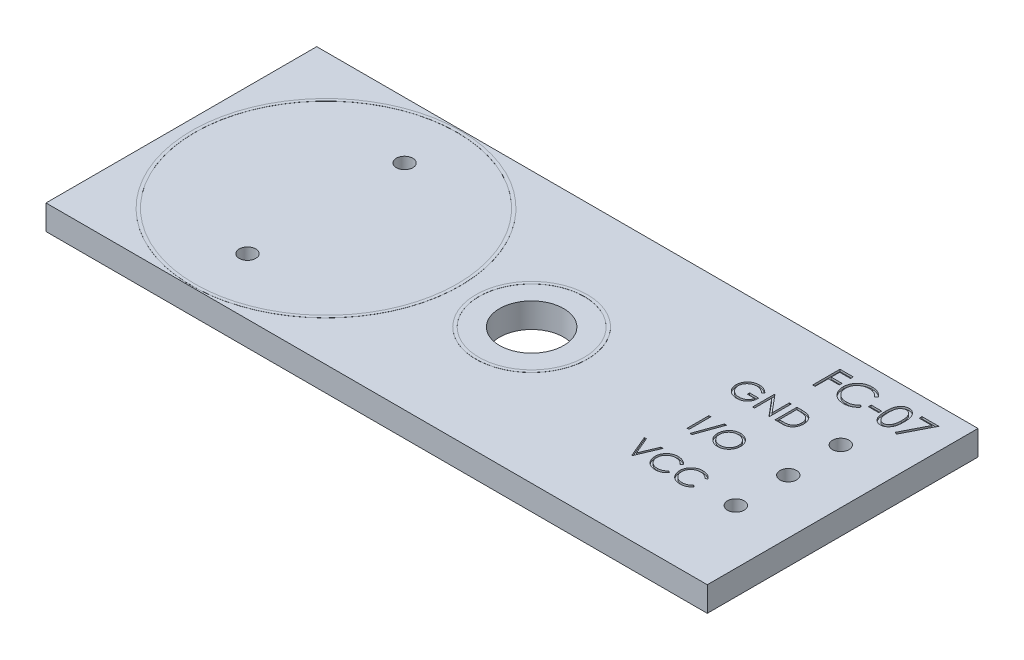
from build123d import *

# Parameters (mm, degrees)
SKETCH1_W           = 32
SKETCH1_H           = 13.1
BOSS_EXTRUDE1_DEPTH = 1.2
CUT_EXTRUDE1_REACH  = 19.33
SKETCH2_R           = 1.55
CUT_EXTRUDE2_REACH  = 19.33
SKETCH4_R           = 0.4
CUT_EXTRUDE3_REACH  = 19.33
SKETCH5_R           = 0.4
SKETCH6_W           = 0.094978632
SKETCH6_H           = 1.058333333
CUT_EXTRUDE4_DEPTH  = 0.1
SKETCH7_W           = 0.508814102
SKETCH7_H           = 0.13568376
CUT_EXTRUDE5_DEPTH  = 0.1
SKETCH8_R           = 6.5
SKETCH8_R_2         = 6.35
SKETCH8_R_3         = 2.7
SKETCH8_R_4         = 2.55
BOSS_EXTRUDE2_DEPTH = 0.005


with BuildPart() as part:
    # Sketch1 → Boss-Extrude1 (new body)
    with BuildSketch(Plane(origin=(0, 0, 0), x_dir=(1, 0, 0), z_dir=(0, 1, 0))):
        Rectangle(SKETCH1_W, SKETCH1_H)
    extrude(amount=BOSS_EXTRUDE1_DEPTH)

    # Sketch2 → Cut-Extrude1 (cut, up to next)
    with BuildSketch(Plane(origin=(0, 1.2, 0), x_dir=(1, 0, 0), z_dir=(0, 1, 0)), mode=Mode.PRIVATE) as cut_extrude1_sk1:
        with Locations(Location((0.95, 0, 0), (0, 0, 270))):
            Circle(SKETCH2_R)
    cut_extrude1_tool1 = extrude(cut_extrude1_sk1.sketch, amount=-CUT_EXTRUDE1_REACH, mode=Mode.PRIVATE) & part.part
    add(cut_extrude1_tool1.solids().sort_by_distance((0.95, 1.2, 0))[0], mode=Mode.SUBTRACT)

    # Sketch4 → Cut-Extrude2 (cut, up to next)
    with BuildSketch(Plane(origin=(0, 1.2, 0), x_dir=(1, 0, 0), z_dir=(0, 1, 0)), mode=Mode.PRIVATE) as cut_extrude2_sk1:
        with Locations(Location((13.37, 0, 0), (0, 0, 270))):
            Circle(SKETCH4_R)
    cut_extrude2_tool1 = extrude(cut_extrude2_sk1.sketch, amount=-CUT_EXTRUDE2_REACH, mode=Mode.PRIVATE) & part.part
    # Sketch4 → Cut-Extrude2 (cut, up to next)
    with BuildSketch(Plane(origin=(0, 1.2, 0), x_dir=(1, 0, 0), z_dir=(0, 1, 0)), mode=Mode.PRIVATE) as cut_extrude2_sk2:
        with Locations(Location((13.37, 2.54, 0), (0, 0, 270))):
            Circle(SKETCH4_R)
    cut_extrude2_tool2 = extrude(cut_extrude2_sk2.sketch, amount=-CUT_EXTRUDE2_REACH, mode=Mode.PRIVATE) & part.part
    # Sketch4 → Cut-Extrude2 (cut, up to next)
    with BuildSketch(Plane(origin=(0, 1.2, 0), x_dir=(1, 0, 0), z_dir=(0, 1, 0)), mode=Mode.PRIVATE) as cut_extrude2_sk3:
        with Locations(Location((13.37, -2.54, 0), (0, 0, 270))):
            Circle(SKETCH4_R)
    cut_extrude2_tool3 = extrude(cut_extrude2_sk3.sketch, amount=-CUT_EXTRUDE2_REACH, mode=Mode.PRIVATE) & part.part
    add(cut_extrude2_tool1.solids().sort_by_distance((13.37, 1.2, 0))[0], mode=Mode.SUBTRACT)
    add(cut_extrude2_tool2.solids().sort_by_distance((13.37, 1.2, -2.54))[0], mode=Mode.SUBTRACT)
    add(cut_extrude2_tool3.solids().sort_by_distance((13.37, 1.2, 2.54))[0], mode=Mode.SUBTRACT)

    # Sketch5 → Cut-Extrude3 (cut, up to next)
    with BuildSketch(Plane(origin=(0, 1.2, 0), x_dir=(1, 0, 0), z_dir=(0, 1, 0)), mode=Mode.PRIVATE) as cut_extrude3_sk1:
        with Locations(Location((-9, -3.8, 0), (0, 0, 270))):
            Circle(SKETCH5_R)
    cut_extrude3_tool1 = extrude(cut_extrude3_sk1.sketch, amount=-CUT_EXTRUDE3_REACH, mode=Mode.PRIVATE) & part.part
    # Sketch5 → Cut-Extrude3 (cut, up to next)
    with BuildSketch(Plane(origin=(0, 1.2, 0), x_dir=(1, 0, 0), z_dir=(0, 1, 0)), mode=Mode.PRIVATE) as cut_extrude3_sk2:
        with Locations(Location((-9, 3.8, 0), (0, 0, 270))):
            Circle(SKETCH5_R)
    cut_extrude3_tool2 = extrude(cut_extrude3_sk2.sketch, amount=-CUT_EXTRUDE3_REACH, mode=Mode.PRIVATE) & part.part
    add(cut_extrude3_tool1.solids().sort_by_distance((-9, 1.2, 3.8))[0], mode=Mode.SUBTRACT)
    add(cut_extrude3_tool2.solids().sort_by_distance((-9, 1.2, -3.8))[0], mode=Mode.SUBTRACT)

    # Sketch6 → Cut-Extrude4 (cut)
    # profile 1 of 9: a face of its own
    with BuildSketch(Plane(origin=(0, 1.2, 0), x_dir=(1, 0, 0), z_dir=(0, 1, 0))):
        with BuildLine():
            Line((9.359822658, 2.876299306), (9.278412401, 2.799129167))
            add(Edge.make_bspline(
                [(9.278412401, 2.799129167), (9.263680738, 2.812987547), (9.234568695, 2.840373846), (9.187106907, 2.875906933), (9.137587904, 2.906346444), (9.086270077, 2.93111333), (9.034424276, 2.95087476), (8.98273867, 2.964943983), (8.931743422, 2.973916393), (8.897826192, 2.974989353), (8.88111339, 2.975518056)],
                knots=[0, 0, 0, 0, 1.08915593, 2.152340314, 3.188132944, 4.216796309, 5.218260357, 6.173443236, 7.099959455, 8, 8, 8, 8], degree=3))
            add(Edge.make_bspline(
                [(8.88111339, 2.975518056), (8.87085823, 2.97539299), (8.850374509, 2.975143181), (8.81994835, 2.971954811), (8.789841295, 2.967369245), (8.760110179, 2.960734439), (8.730697195, 2.952325509), (8.70170464, 2.941807048), (8.67307843, 2.929543914), (8.64508821, 2.915373595), (8.617952391, 2.89980707), (8.592323539, 2.882556678), (8.568038297, 2.864175306), (8.54555312, 2.844202748), (8.524738671, 2.822819919), (8.505099521, 2.800424586), (8.487326386, 2.776404889), (8.471272629, 2.751202759), (8.456951378, 2.725260835), (8.444309237, 2.698828812), (8.433696546, 2.671994361), (8.425299592, 2.644723809), (8.418371847, 2.617228131), (8.413498189, 2.589316941), (8.410750537, 2.560960356), (8.410275261, 2.541971661), (8.410036333, 2.532425775)],
                knots=[0, 0, 0, 0, 1.02818874, 2.053710826, 3.065248034, 4.081641283, 5.106893873, 6.131558223, 7.173050175, 8.228653731, 9.27666206, 10.308777013, 11.325269123, 12.329503258, 13.32196095, 14.316845687, 15.314881793, 16.315733098, 17.311955233, 18.285320748, 19.252783886, 20.203351036, 21.145449891, 22.095197417, 23.042428769, 24, 24, 24, 24], degree=3))
            add(Edge.make_bspline(
                [(8.410036333, 2.532425775), (8.410264848, 2.522667695), (8.410721253, 2.50317818), (8.41364235, 2.474090925), (8.419063508, 2.445435672), (8.426310887, 2.41711826), (8.435376515, 2.389090192), (8.446677297, 2.361472981), (8.460062371, 2.334267649), (8.475555329, 2.307719321), (8.492544967, 2.281858788), (8.511577755, 2.257499123), (8.531795122, 2.234315945), (8.553933611, 2.212823988), (8.57728333, 2.192448382), (8.602541899, 2.173750498), (8.629212643, 2.156370178), (8.657336252, 2.140526468), (8.68660757, 2.126372459), (8.716620921, 2.113786185), (8.747472189, 2.103420767), (8.778999241, 2.094972816), (8.811164492, 2.088048202), (8.844131213, 2.083593381), (8.877657008, 2.080360677), (8.900256547, 2.080124315), (8.911642236, 2.080005236)],
                knots=[0, 0, 0, 0, 0.93586088, 1.869166235, 2.799637598, 3.729985548, 4.670839027, 5.622275134, 6.589130586, 7.576015415, 8.568469353, 9.55398029, 10.53834874, 11.515998671, 12.510579167, 13.508179873, 14.527009472, 15.561807829, 16.601455013, 17.643573243, 18.680854198, 19.719860599, 20.772568776, 21.833555941, 22.908541556, 24, 24, 24, 24], degree=3))
            add(Edge.make_bspline(
                [(8.911642236, 2.080005236), (8.925363784, 2.080292067), (8.952308272, 2.080855307), (8.991916077, 2.085239918), (9.02995653, 2.092087877), (9.066322739, 2.102116613), (9.101056943, 2.114908438), (9.134286475, 2.130328472), (9.165749715, 2.148968159), (9.195541246, 2.170005971), (9.22298449, 2.19344498), (9.247735618, 2.21873747), (9.269399849, 2.245760671), (9.28830008, 2.274355421), (9.303935792, 2.304758406), (9.316769685, 2.336820633), (9.326607132, 2.370556524), (9.330645422, 2.393867565), (9.332685906, 2.405646261)],
                knots=[0, 0, 0, 0, 1.13008108, 2.219097802, 3.278683437, 4.311054135, 5.322181354, 6.324827112, 7.324222904, 8.330512327, 9.32562643, 10.293043162, 11.24128371, 12.174520618, 13.111833804, 14.052305215, 15.015860969, 16, 16, 16, 16], degree=3))
            Line((9.332685906, 2.405646261), (8.979908128, 2.405646261))
            Line((8.979908128, 2.405646261), (8.979908128, 2.51419327))
            Line((8.979908128, 2.51419327), (9.427664538, 2.51419327))
            add(Edge.make_bspline(
                [(9.427664538, 2.51419327), (9.427148722, 2.49396172), (9.426139177, 2.454364921), (9.419057743, 2.396619149), (9.40762275, 2.342078184), (9.392001655, 2.290684589), (9.371779845, 2.242511193), (9.347174342, 2.197509086), (9.317791343, 2.155968994), (9.284677472, 2.117551796), (9.247514866, 2.0832832), (9.207307688, 2.053164262), (9.163989509, 2.027793709), (9.117601305, 2.007152985), (9.068294936, 1.991043944), (9.015956307, 1.979622539), (8.960656394, 1.972779669), (8.922756971, 1.971905371), (8.903374007, 1.971458227)],
                knots=[0, 0, 0, 0, 1.140356446, 2.231883559, 3.274166699, 4.278491846, 5.25512956, 6.21435461, 7.1637429, 8.11826594, 9.068280886, 10.0076534, 10.945064095, 11.891975133, 12.864533718, 13.863980011, 14.907571808, 16, 16, 16, 16], degree=3))
            add(Edge.make_bspline(
                [(8.903374007, 1.971458227), (8.891426894, 1.971630318), (8.867863338, 1.971969738), (8.833062034, 1.974381936), (8.799220277, 1.978095348), (8.766342998, 1.983703041), (8.734309261, 1.990571519), (8.703279053, 1.999366789), (8.67313417, 2.009547562), (8.643828017, 2.021127445), (8.615626594, 2.034544588), (8.58840429, 2.049454884), (8.562010629, 2.065781448), (8.536625395, 2.083806632), (8.512116324, 2.103395614), (8.488641449, 2.124587656), (8.466069353, 2.147317971), (8.451929879, 2.163458767), (8.444805297, 2.171591774)],
                knots=[0, 0, 0, 0, 1.107784379, 2.184907829, 3.233506516, 4.263428166, 5.276301166, 6.270063455, 7.25232949, 8.225834625, 9.190232166, 10.146266622, 11.1027726, 12.066435141, 13.031522626, 14.010570082, 14.99756817, 16, 16, 16, 16], degree=3))
            add(Edge.make_bspline(
                [(8.444805297, 2.171591774), (8.434468122, 2.184494567), (8.413965359, 2.210085979), (8.387574107, 2.251088819), (8.36507654, 2.293543668), (8.34682246, 2.33756871), (8.332568801, 2.383122767), (8.322346434, 2.430147629), (8.316357087, 2.478703851), (8.315494232, 2.511562157), (8.3150577, 2.528185658)],
                knots=[0, 0, 0, 0, 1.023165419, 2.029347347, 3.013907458, 3.994755782, 4.975994455, 5.96558838, 6.970761222, 8, 8, 8, 8], degree=3))
            add(Edge.make_bspline(
                [(8.3150577, 2.528185658), (8.315218639, 2.540633548), (8.315538471, 2.565371125), (8.319416663, 2.602097501), (8.324980901, 2.638171758), (8.333159415, 2.673564407), (8.343469476, 2.708299086), (8.35633684, 2.742391923), (8.371318273, 2.775863036), (8.38873103, 2.808482039), (8.40810895, 2.839816088), (8.429139612, 2.869739043), (8.452121653, 2.897705974), (8.476679763, 2.924071068), (8.503106949, 2.9485031), (8.531155631, 2.971228272), (8.560847428, 2.992277066), (8.592275749, 3.011317944), (8.624971501, 3.028421706), (8.658856311, 3.043416539), (8.693919835, 3.055809113), (8.729899382, 3.066324042), (8.767067293, 3.07409981), (8.805153848, 3.079738836), (8.844357573, 3.083597398), (8.870857039, 3.083907718), (8.884293478, 3.084065065)],
                knots=[0, 0, 0, 0, 1.008945113, 2.00506715, 2.99143336, 3.967273523, 4.948097931, 5.927297278, 6.919902385, 7.919676788, 8.923139349, 9.905703106, 10.883022732, 11.856032218, 12.825136022, 13.798837087, 14.781400844, 15.773989409, 16.776158564, 17.77167057, 18.775803737, 19.789618931, 20.80898985, 21.851988756, 22.910860228, 24, 24, 24, 24], degree=3))
            add(Edge.make_bspline(
                [(8.884293478, 3.084065065), (8.895251232, 3.083889837), (8.916979172, 3.083542382), (8.949311477, 3.081134024), (8.981144031, 3.077316803), (9.012524035, 3.072107751), (9.043344627, 3.065012778), (9.073693607, 3.05652244), (9.103614969, 3.046637055), (9.133014939, 3.034847571), (9.162091201, 3.021466117), (9.191005424, 3.006403487), (9.219658815, 2.989402117), (9.248101064, 2.970411524), (9.276511526, 2.949757871), (9.304440835, 2.926850451), (9.332563154, 2.902592618), (9.350646083, 2.885150624), (9.359822658, 2.876299306)],
                knots=[0, 0, 0, 0, 0.985871117, 1.954866573, 2.915460327, 3.869826059, 4.81536089, 5.759505086, 6.70452669, 7.649098992, 8.607881297, 9.583363685, 10.581137262, 11.603961102, 12.659522466, 13.73993555, 14.853081303, 16, 16, 16, 16], degree=3))
        make_face()
    # profile 2 of 9: a face of its own
    with BuildSketch(Plane(origin=(0, 1.2, 0), x_dir=(1, 0, 0), z_dir=(0, 1, 0))):
        Polygon((9.644758555, 1.998594979), (9.644758555, 3.056928312), (9.664687108, 3.056928312), (10.363882487, 2.223957225), (10.363882487, 3.056928312), (10.458861119, 3.056928312), (10.458861119, 1.998594979), (10.43723652, 1.998594979), (9.739737188, 2.829658013), (9.739737188, 1.998594979), align=None)
    # profile 3 of 9: a face of its own
    with BuildSketch(Plane(origin=(0, 1.2, 0), x_dir=(1, 0, 0), z_dir=(0, 1, 0))):
        with BuildLine():
            Line((10.730228641, 1.998594979), (10.730228641, 3.056928312))
            Line((10.730228641, 3.056928312), (10.943930564, 3.056928312))
            add(Edge.make_bspline(
                [(10.943930564, 3.056928312), (10.962517615, 3.056794488), (10.998427701, 3.056535939), (11.050320036, 3.054896614), (11.098333222, 3.051996639), (11.142309348, 3.047772521), (11.182369143, 3.04258577), (11.218400437, 3.036084457), (11.250589537, 3.028407558), (11.270386249, 3.021862386), (11.279747871, 3.018767255)],
                knots=[0, 0, 0, 0, 1.314313732, 2.53924729, 3.670748893, 4.714932338, 5.66265055, 6.526160246, 7.303039223, 8, 8, 8, 8], degree=3))
            add(Edge.make_bspline(
                [(11.279747871, 3.018767255), (11.291992709, 3.014101303), (11.316204713, 3.004875209), (11.350678295, 2.987471279), (11.38313144, 2.96775208), (11.413738182, 2.945691616), (11.441799384, 2.920665254), (11.468411296, 2.893736088), (11.492485272, 2.863924851), (11.514531352, 2.831849795), (11.534408563, 2.79788877), (11.551686356, 2.762106487), (11.56603554, 2.724684665), (11.577947301, 2.68572737), (11.587335158, 2.645148942), (11.593740171, 2.60290213), (11.597964732, 2.559153899), (11.598389291, 2.529467811), (11.598604709, 2.514405276)],
                knots=[0, 0, 0, 0, 0.984719456, 1.947108742, 2.898477687, 3.838006223, 4.779231079, 5.722358779, 6.681677486, 7.655904652, 8.64651281, 9.637519902, 10.640069247, 11.656948941, 12.698408672, 13.768548281, 14.867775369, 16, 16, 16, 16], degree=3))
            add(Edge.make_bspline(
                [(11.598604709, 2.514405276), (11.598414521, 2.501323901), (11.598039736, 2.475545686), (11.594674443, 2.437554273), (11.589783032, 2.400689931), (11.582210144, 2.365128207), (11.573017003, 2.330557532), (11.561234986, 2.297346353), (11.547738062, 2.265190011), (11.53199917, 2.234523298), (11.514720703, 2.205469516), (11.496178176, 2.178081202), (11.476391366, 2.15274917), (11.455171591, 2.129396709), (11.432793068, 2.108059022), (11.409109282, 2.088557865), (11.384059121, 2.071274812), (11.357754784, 2.05553071), (11.329428907, 2.04179646), (11.298544966, 2.030175957), (11.264971253, 2.020546147), (11.228790175, 2.012511614), (11.189939219, 2.006138239), (11.148380294, 2.001866687), (11.104177251, 1.998978062), (11.073824473, 1.998725153), (11.058201731, 1.998594979)],
                knots=[0, 0, 0, 0, 1.105936401, 2.179363191, 3.223086493, 4.248585256, 5.251745608, 6.245858792, 7.225916811, 8.198733463, 9.158002045, 10.082870192, 10.993790845, 11.873723703, 12.748670949, 13.606408763, 14.465103618, 15.319838547, 16.196477973, 17.123216899, 18.106603292, 19.147568657, 20.255746949, 21.433717677, 22.679120308, 24, 24, 24, 24], degree=3))
            Line((11.058201731, 1.998594979), (10.730228641, 1.998594979))
        make_face()
        with BuildLine():
            Line((10.825207273, 2.107141988), (10.94668664, 2.107141988))
            add(Edge.make_bspline(
                [(10.94668664, 2.107141988), (10.9641426, 2.107217007), (10.997716803, 2.107361297), (11.04599434, 2.108627428), (11.090105491, 2.1106963), (11.130056519, 2.113591621), (11.165824867, 2.117422369), (11.197485287, 2.12169347), (11.224933996, 2.127014604), (11.241543611, 2.13183787), (11.249219025, 2.134066734)],
                knots=[0, 0, 0, 0, 1.375205317, 2.645023457, 3.804390687, 4.853969522, 5.800190428, 6.637939096, 7.370582563, 8, 8, 8, 8], degree=3))
            add(Edge.make_bspline(
                [(11.249219025, 2.134066734), (11.258879601, 2.137468991), (11.277970011, 2.144192242), (11.30545072, 2.156456106), (11.331079624, 2.170983113), (11.35530337, 2.187130943), (11.377778335, 2.205469139), (11.398770865, 2.225598938), (11.418238695, 2.247622787), (11.435980688, 2.27151335), (11.451858199, 2.297121931), (11.465607833, 2.324196769), (11.477658177, 2.352441209), (11.487116228, 2.382288978), (11.494529274, 2.413473241), (11.499780024, 2.445996192), (11.503050191, 2.479851755), (11.503431629, 2.502878707), (11.503626077, 2.514617281)],
                knots=[0, 0, 0, 0, 0.998632004, 1.973411704, 2.929992603, 3.868527914, 4.809262121, 5.754881198, 6.702106254, 7.672490631, 8.653608572, 9.636854334, 10.631411391, 11.644891563, 12.686317036, 13.754757253, 14.855430412, 16, 16, 16, 16], degree=3))
            add(Edge.make_bspline(
                [(11.503626077, 2.514617281), (11.503470868, 2.526994786), (11.50316596, 2.551310504), (11.49933349, 2.586988643), (11.493732924, 2.62130303), (11.485634048, 2.65425596), (11.47531352, 2.685911724), (11.462433712, 2.716095243), (11.447717853, 2.745125286), (11.430208987, 2.772331821), (11.41103332, 2.798062356), (11.389752389, 2.821634438), (11.366704297, 2.843101762), (11.342140426, 2.862798649), (11.315368493, 2.879932665), (11.287019163, 2.895259352), (11.256676543, 2.908266539), (11.235566514, 2.915184671), (11.22483835, 2.918700481)],
                knots=[0, 0, 0, 0, 1.122418816, 2.205001699, 3.251619955, 4.274784885, 5.280384055, 6.268708349, 7.249350384, 8.229342522, 9.199999885, 10.157847722, 11.105861043, 12.055065948, 13.010012805, 13.98527497, 14.976112212, 16, 16, 16, 16], degree=3))
            add(Edge.make_bspline(
                [(11.22483835, 2.918700481), (11.215963122, 2.921154734), (11.197091953, 2.92637315), (11.166297639, 2.932065584), (11.131640201, 2.937086468), (11.092965767, 2.941337352), (11.050318424, 2.944387566), (11.00366537, 2.946676987), (10.952986442, 2.948221135), (10.917855057, 2.948326578), (10.899621336, 2.948381304)],
                knots=[0, 0, 0, 0, 0.674548936, 1.434276114, 2.292660221, 3.240891867, 4.284742987, 5.42552168, 6.663806718, 8, 8, 8, 8], degree=3))
            Line((10.899621336, 2.948381304), (10.825207273, 2.948381304))
            Line((10.825207273, 2.948381304), (10.825207273, 2.107141988))
        make_face(mode=Mode.SUBTRACT)
    # profile 4 of 9: a face of its own
    with BuildSketch(Plane(origin=(0, 1.2, 0), x_dir=(1, 0, 0), z_dir=(0, 1, 0))):
        with Locations((9.000260692, 0.046631621)):
            Rectangle(SKETCH6_W, SKETCH6_H)
    # profile 5 of 9: a face of its own
    with BuildSketch(Plane(origin=(0, 1.2, 0), x_dir=(1, 0, 0), z_dir=(0, 1, 0))):
        Polygon((9.780442316, 0.60293504), (9.337774047, -0.631787182), (9.237707273, -0.631787182), (9.680375542, 0.60293504), align=None)
    # profile 6 of 9: a face of its own
    with BuildSketch(Plane(origin=(0, 1.2, 0), x_dir=(1, 0, 0), z_dir=(0, 1, 0))):
        with BuildLine():
            add(Edge.make_bspline(
                [(10.452076931, 0.60293504), (10.471673668, 0.602438688), (10.510163276, 0.601463812), (10.566731162, 0.594001321), (10.620734917, 0.581091048), (10.672614459, 0.563896765), (10.72174924, 0.540959844), (10.768509095, 0.513236002), (10.812782769, 0.480434787), (10.85397352, 0.442809759), (10.891667407, 0.401872381), (10.924876663, 0.358185013), (10.9527085, 0.312011804), (10.975564202, 0.263491505), (10.993494972, 0.212733848), (11.005868112, 0.159468233), (11.01377179, 0.104039781), (11.014695799, 0.066234039), (11.015164538, 0.047055633)],
                knots=[0, 0, 0, 0, 1.065120563, 2.091984664, 3.0946048, 4.079830382, 5.057816894, 6.036188127, 7.030412546, 8.04752943, 9.064399622, 10.05169764, 11.02544977, 11.989514704, 12.962713494, 13.945757189, 14.957906945, 16, 16, 16, 16], degree=3))
            add(Edge.make_bspline(
                [(11.015164538, 0.047055633), (11.014695868, 0.028018501), (11.013772065, -0.009505893), (11.005859125, -0.064582601), (10.993449108, -0.117526693), (10.975730714, -0.168249783), (10.952983962, -0.21680538), (10.924966803, -0.263065721), (10.89196458, -0.307045971), (10.854406794, -0.348264325), (10.813464098, -0.386061179), (10.769549231, -0.418996172), (10.723649823, -0.447336562), (10.675175221, -0.469949721), (10.624768305, -0.488023611), (10.571977935, -0.50034643), (10.517051477, -0.508295131), (10.479595245, -0.509207873), (10.460557166, -0.509671797)],
                knots=[0, 0, 0, 0, 1.043624062, 2.057103931, 3.04512605, 4.022047818, 4.998200453, 5.980619268, 6.982898556, 8.009068085, 9.034988726, 10.034168286, 11.015286542, 11.987931943, 12.962482838, 13.94673481, 14.956375938, 16, 16, 16, 16], degree=3))
            add(Edge.make_bspline(
                [(10.460557166, -0.509671797), (10.44137886, -0.509203292), (10.403573314, -0.508279744), (10.34807521, -0.500362986), (10.294772178, -0.487983115), (10.243816648, -0.470290976), (10.195180205, -0.447425766), (10.148767728, -0.419544918), (10.10476551, -0.386462283), (10.063538363, -0.348916676), (10.025816581, -0.308043373), (9.992929818, -0.264248253), (9.9650427, -0.218390532), (9.942254264, -0.170342947), (9.924212868, -0.120337773), (9.911904506, -0.068041447), (9.903941016, -0.01375212), (9.903023336, 0.023211804), (9.9025577, 0.041967492)],
                knots=[0, 0, 0, 0, 1.053102029, 2.075944431, 3.073151272, 4.055350789, 5.033113405, 6.020478099, 7.024410459, 8.052272461, 9.079885166, 10.07527673, 11.055994387, 12.023226415, 12.992069828, 13.970394897, 14.97016774, 16, 16, 16, 16], degree=3))
            add(Edge.make_bspline(
                [(9.9025577, 0.041967492), (9.902719364, 0.054556418), (9.903040652, 0.079575456), (9.906908616, 0.116727975), (9.912521321, 0.153283008), (9.920565232, 0.189136604), (9.93108557, 0.224200997), (9.943498921, 0.258718013), (9.958660255, 0.292337853), (9.975799404, 0.325219784), (9.994928569, 0.356851222), (10.016057665, 0.386750524), (10.03844455, 0.415168588), (10.062986814, 0.441368991), (10.088875597, 0.46611393), (10.116530868, 0.489023133), (10.14578388, 0.510303177), (10.176760505, 0.529480281), (10.208697459, 0.54682459), (10.241619723, 0.561708341), (10.275080162, 0.574482745), (10.309235496, 0.584836518), (10.343995025, 0.593010491), (10.379434612, 0.598576524), (10.415526024, 0.602454354), (10.439840876, 0.602774122), (10.452076931, 0.60293504)],
                knots=[0, 0, 0, 0, 1.037015668, 2.060948919, 3.074880161, 4.083647147, 5.086022904, 6.090072063, 7.104153813, 8.122640571, 9.144368836, 10.147691507, 11.138137339, 12.123020368, 13.103399296, 14.087645067, 15.080126199, 16.082011238, 17.087798457, 18.072939717, 19.057185487, 20.037253025, 21.01195951, 21.997135196, 22.992090687, 24, 24, 24, 24], degree=3))
        make_face()
        with BuildLine():
            add(Edge.make_bspline(
                [(10.456741061, 0.494388032), (10.446697588, 0.494265601), (10.426706659, 0.494021909), (10.396987288, 0.490811919), (10.367658774, 0.486236928), (10.338715062, 0.479711088), (10.310277256, 0.470819862), (10.28208028, 0.460587016), (10.254381261, 0.448122544), (10.227271642, 0.434039845), (10.200990179, 0.418452433), (10.1761911, 0.401225256), (10.152810206, 0.382762312), (10.130904742, 0.363020514), (10.11053903, 0.341899325), (10.091312228, 0.319718945), (10.073994997, 0.295845397), (10.058124358, 0.27092606), (10.043922178, 0.244993391), (10.03129313, 0.218320409), (10.020962585, 0.190689537), (10.012537533, 0.162400542), (10.00555259, 0.133498227), (10.00112757, 0.103763339), (9.997882309, 0.073345293), (9.997652546, 0.052788875), (9.997536333, 0.042391504)],
                knots=[0, 0, 0, 0, 1.008559885, 2.007477868, 2.99961109, 3.989939068, 4.984837346, 5.991145699, 7.001802488, 8.033829008, 9.059044045, 10.069351652, 11.065060232, 12.050310815, 13.029377138, 14.011219647, 14.996725999, 15.989392538, 16.977580475, 17.965360261, 18.951710183, 19.937753436, 20.929683414, 21.935841486, 22.955955122, 24, 24, 24, 24], degree=3))
            add(Edge.make_bspline(
                [(9.997536333, 0.042391504), (9.997921827, 0.027102452), (9.998680213, -0.002975845), (10.005319764, -0.047053355), (10.015546885, -0.089413384), (10.030622803, -0.129824152), (10.049476441, -0.168633018), (10.072767905, -0.205495707), (10.100362914, -0.240422181), (10.13170879, -0.273168608), (10.165975418, -0.303057696), (10.202361744, -0.329293298), (10.240477954, -0.35149116), (10.280423446, -0.369575074), (10.321984964, -0.383904828), (10.365430318, -0.393725748), (10.4104701, -0.400189278), (10.441171036, -0.400809993), (10.456741061, -0.401124789)],
                knots=[0, 0, 0, 0, 1.032063989, 2.030389145, 3.003944642, 3.970395727, 4.937377036, 5.913328081, 6.909231446, 7.93887556, 8.970685674, 9.976071282, 10.964166581, 11.944589148, 12.933237628, 13.927779006, 14.949070134, 16, 16, 16, 16], degree=3))
            add(Edge.make_bspline(
                [(10.456741061, -0.401124789), (10.467206315, -0.400981005), (10.487962057, -0.400695839), (10.518833798, -0.397823621), (10.549149367, -0.393217793), (10.578866242, -0.386586381), (10.607950697, -0.378286868), (10.636524125, -0.368426913), (10.66428218, -0.356125691), (10.691575035, -0.342534287), (10.717699613, -0.327040239), (10.742638643, -0.310397751), (10.765763523, -0.291962002), (10.787652599, -0.27251352), (10.808101924, -0.251660166), (10.826973212, -0.229429052), (10.844202919, -0.205679853), (10.860067531, -0.180798314), (10.874219946, -0.154794685), (10.886550769, -0.128024996), (10.897011975, -0.100555166), (10.905457023, -0.072345571), (10.91207477, -0.043449791), (10.916634651, -0.013829134), (10.919824298, 0.016457143), (10.920064714, 0.036941595), (10.920185906, 0.047267639)],
                knots=[0, 0, 0, 0, 1.047197238, 2.076906641, 3.100256066, 4.114471768, 5.12198147, 6.126382909, 7.136867548, 8.15857795, 9.17633901, 10.174870724, 11.156907918, 12.133735059, 13.104061851, 14.077631395, 15.04955518, 16.038496417, 17.029181396, 18.010275684, 18.986308667, 19.968651475, 20.955262928, 21.950658345, 22.966943676, 24, 24, 24, 24], degree=3))
            add(Edge.make_bspline(
                [(10.920185906, 0.047267639), (10.920064617, 0.057523042), (10.919824018, 0.077866522), (10.916636174, 0.107941579), (10.912069953, 0.137349097), (10.905489324, 0.165973628), (10.897007492, 0.193822468), (10.886548942, 0.220869461), (10.874216244, 0.247215367), (10.860062329, 0.272795071), (10.844152306, 0.297340766), (10.826767142, 0.320806257), (10.807606668, 0.342750872), (10.787218322, 0.363716363), (10.76509284, 0.383255582), (10.741330446, 0.401375011), (10.71621962, 0.418511929), (10.689632099, 0.433971325), (10.662192856, 0.44824801), (10.634036968, 0.460479623), (10.605483407, 0.470873097), (10.576604783, 0.479737989), (10.547158025, 0.486211369), (10.517342106, 0.490816042), (10.487198275, 0.494020792), (10.466925682, 0.49426523), (10.456741061, 0.494388032)],
                knots=[0, 0, 0, 0, 1.02996197, 2.043119294, 3.035359645, 4.018872909, 4.991431989, 5.957985074, 6.929999688, 7.912076566, 8.892894881, 9.867085534, 10.843653904, 11.817741046, 12.803660682, 13.806313499, 14.818574707, 15.856120519, 16.894564902, 17.924820532, 18.937903209, 19.946497019, 20.957711757, 21.963978472, 22.977135795, 24, 24, 24, 24], degree=3))
        make_face(mode=Mode.SUBTRACT)
    # profile 7 of 9: a face of its own
    with BuildSketch(Plane(origin=(0, 1.2, 0), x_dir=(1, 0, 0), z_dir=(0, 1, 0))):
        Polygon((8.308273512, -1.905331736), (8.410036333, -1.905331736), (8.762814111, -2.739362853), (9.115591888, -1.905331736), (9.217354709, -1.905331736), (8.769598299, -2.963665069), (8.756029923, -2.963665069), align=None)
    # profile 8 of 9: a face of its own
    with BuildSketch(Plane(origin=(0, 1.2, 0), x_dir=(1, 0, 0), z_dir=(0, 1, 0))):
        with BuildLine():
            Line((10.384235051, -2.099529119), (10.301128747, -2.163130881))
            add(Edge.make_bspline(
                [(10.301128747, -2.163130881), (10.2952003, -2.156065457), (10.283423334, -2.142029866), (10.264476385, -2.122320813), (10.244730412, -2.103855841), (10.224192963, -2.086546987), (10.202494372, -2.070999537), (10.180160274, -2.056403275), (10.156817055, -2.043319935), (10.124537364, -2.027456127), (10.082310515, -2.010901933), (10.029153504, -1.99702167), (9.973663243, -1.988185743), (9.935805874, -1.987228755), (9.916550088, -1.986741993)],
                knots=[0, 0, 0, 0, 0.757959112, 1.505699292, 2.245454638, 2.979532153, 3.711538275, 4.438200793, 5.171680507, 5.909471876, 7.393775596, 8.890124382, 10.418191784, 12, 12, 12, 12], degree=3))
            add(Edge.make_bspline(
                [(9.916550088, -1.986741993), (9.905941567, -1.986864143), (9.884822981, -1.987107311), (9.853481657, -1.990315308), (9.822725568, -1.994824174), (9.792574719, -2.00151445), (9.763067492, -2.009972837), (9.734010979, -2.020080046), (9.70582587, -2.032584962), (9.678122259, -2.046406269), (9.651579498, -2.062017425), (9.626465234, -2.07904551), (9.602871062, -2.097299975), (9.58077832, -2.116849238), (9.560164421, -2.137605259), (9.541178735, -2.159789239), (9.523886956, -2.183330253), (9.507946331, -2.207917879), (9.4936701, -2.233480497), (9.481717018, -2.26011272), (9.471132135, -2.287358485), (9.462756412, -2.315525621), (9.456126856, -2.344415934), (9.451552539, -2.374106958), (9.448381025, -2.404536666), (9.448139066, -2.425161863), (9.448017102, -2.435558432)],
                knots=[0, 0, 0, 0, 1.054917814, 2.100044995, 3.131103042, 4.146048494, 5.169673617, 6.183595914, 7.203665975, 8.234915748, 9.262203917, 10.264457458, 11.251630812, 12.227803204, 13.197192746, 14.159520551, 15.12972552, 16.100847026, 17.073214652, 18.039054194, 19.002613845, 19.979014051, 20.95965708, 21.949030935, 22.966165397, 24, 24, 24, 24], degree=3))
            add(Edge.make_bspline(
                [(9.448017102, -2.435558432), (9.448398652, -2.451200998), (9.449147775, -2.481913101), (9.455814771, -2.5268985), (9.465946073, -2.569994037), (9.481130307, -2.610930323), (9.499853448, -2.650212136), (9.523511919, -2.687174837), (9.550912634, -2.722376988), (9.582443232, -2.754986641), (9.617037372, -2.784775316), (9.654154002, -2.811007039), (9.693700679, -2.832873682), (9.735240756, -2.851069742), (9.77909389, -2.865056895), (9.825181223, -2.874903666), (9.873402517, -2.881326897), (9.906352788, -2.881941845), (9.92312227, -2.882254813)],
                knots=[0, 0, 0, 0, 1.029171465, 2.020641659, 2.987623507, 3.938342917, 4.889210282, 5.84687017, 6.821220943, 7.821438502, 8.827599549, 9.822697543, 10.807740252, 11.797342354, 12.80366471, 13.83203677, 14.896651826, 16, 16, 16, 16], degree=3))
            add(Edge.make_bspline(
                [(9.92312227, -2.882254813), (9.94159856, -2.881744158), (9.977964317, -2.880739067), (10.031294649, -2.872224247), (10.082347368, -2.858418162), (10.131125222, -2.839096647), (10.177490698, -2.813979287), (10.221516355, -2.783530167), (10.263239354, -2.747459647), (10.288328289, -2.719917844), (10.301128747, -2.705865924)],
                knots=[0, 0, 0, 0, 1.028121516, 2.023589091, 2.998037872, 3.967518031, 4.937445131, 5.927275754, 6.942489185, 8, 8, 8, 8], degree=3))
            Line((10.301128747, -2.705865924), (10.384235051, -2.768831669))
            add(Edge.make_bspline(
                [(10.384235051, -2.768831669), (10.377546956, -2.777461154), (10.364202801, -2.794678787), (10.342595258, -2.818951423), (10.319832837, -2.841782406), (10.295746468, -2.862987663), (10.270613231, -2.882991513), (10.243981841, -2.901225638), (10.216202395, -2.917944548), (10.187369017, -2.933253166), (10.157512341, -2.946835286), (10.126668143, -2.958462973), (10.094969374, -2.968479308), (10.062414585, -2.976719775), (10.028936249, -2.983151746), (9.994655177, -2.987451504), (9.959497381, -2.990397274), (9.935778189, -2.990665763), (9.923758288, -2.990801822)],
                knots=[0, 0, 0, 0, 0.986787822, 1.968848986, 2.935600012, 3.899624008, 4.868462664, 5.837806735, 6.815139263, 7.798259679, 8.787526145, 9.778297419, 10.776456485, 11.791383307, 12.812564526, 13.85620153, 14.913611965, 16, 16, 16, 16], degree=3))
            add(Edge.make_bspline(
                [(9.923758288, -2.990801822), (9.91237556, -2.9907226), (9.889867625, -2.990565949), (9.856636336, -2.988028318), (9.824284725, -2.984566135), (9.792905255, -2.979353048), (9.762326686, -2.973201307), (9.732826223, -2.964954999), (9.704113577, -2.955717512), (9.676304102, -2.944860528), (9.649374145, -2.932609207), (9.623410564, -2.918762711), (9.5984253, -2.903437481), (9.574172709, -2.886971323), (9.551011058, -2.868835329), (9.528739635, -2.849281371), (9.507233553, -2.828375353), (9.493927979, -2.813300195), (9.487238189, -2.805720692)],
                knots=[0, 0, 0, 0, 1.114604814, 2.203992996, 3.262667896, 4.300477797, 5.318619304, 6.316056647, 7.298880507, 8.271930387, 9.238335007, 10.195173496, 11.151986948, 12.108099108, 13.064862484, 14.031167946, 15.010108607, 16, 16, 16, 16], degree=3))
            add(Edge.make_bspline(
                [(9.487238189, -2.805720692), (9.476523126, -2.792554666), (9.45522236, -2.766381565), (9.42797007, -2.723961756), (9.404642119, -2.67967256), (9.385780828, -2.633281296), (9.371035907, -2.584892062), (9.360821117, -2.534480466), (9.35418337, -2.482093588), (9.353424306, -2.446461988), (9.35303847, -2.428350232)],
                knots=[0, 0, 0, 0, 0.994628077, 1.977248131, 2.950237994, 3.925870899, 4.908910175, 5.911660606, 6.938484602, 8, 8, 8, 8], degree=3))
            add(Edge.make_bspline(
                [(9.35303847, -2.428350232), (9.353508731, -2.409313702), (9.35443394, -2.371860518), (9.362294573, -2.316895537), (9.37493978, -2.264235471), (9.392900268, -2.213978625), (9.415671172, -2.165860659), (9.443800648, -2.120249152), (9.476961903, -2.076852405), (9.514894858, -2.036328897), (9.5564926, -1.999275331), (9.601039003, -1.966676788), (9.648446878, -1.93954792), (9.698193942, -1.916870509), (9.750652708, -1.899439922), (9.80571125, -1.887237887), (9.863266113, -1.879642949), (9.902534037, -1.878682827), (9.922486253, -1.878194984)],
                knots=[0, 0, 0, 0, 1.032925535, 2.032216505, 3.007276963, 3.968222605, 4.92396291, 5.891752235, 6.871517503, 7.883894988, 8.900124299, 9.891468569, 10.874487609, 11.85992873, 12.854644235, 13.869047385, 14.917252991, 16, 16, 16, 16], degree=3))
            add(Edge.make_bspline(
                [(9.922486253, -1.878194984), (9.934646343, -1.878340773), (9.958716017, -1.878629349), (9.994322177, -1.881443349), (10.028987833, -1.886134368), (10.062736868, -1.892519465), (10.095733468, -1.90044406), (10.127725446, -1.910767436), (10.158900525, -1.92257134), (10.18906209, -1.936165923), (10.218065428, -1.951426105), (10.245901505, -1.968182734), (10.272349212, -1.986415037), (10.29759465, -2.005967949), (10.321215504, -2.027255133), (10.343882427, -2.049691072), (10.364825658, -2.073922015), (10.37775341, -2.090977792), (10.384235051, -2.099529119)],
                knots=[0, 0, 0, 0, 1.096760587, 2.17092713, 3.219439832, 4.250915756, 5.268269357, 6.278326846, 7.281116186, 8.274029601, 9.260640565, 10.235837813, 11.203064059, 12.156899882, 13.114053108, 14.069676657, 15.032185724, 16, 16, 16, 16], degree=3))
        make_face()
    # profile 9 of 9: a face of its own
    with BuildSketch(Plane(origin=(0, 1.2, 0), x_dir=(1, 0, 0), z_dir=(0, 1, 0))):
        with BuildLine():
            Line((11.578252145, -2.099529119), (11.495145841, -2.163130881))
            add(Edge.make_bspline(
                [(11.495145841, -2.163130881), (11.489217394, -2.156065457), (11.477440428, -2.142029866), (11.458493479, -2.122320813), (11.438747506, -2.103855841), (11.418210057, -2.086546987), (11.396511466, -2.070999537), (11.374177368, -2.056403275), (11.350834149, -2.043319935), (11.318554458, -2.027456127), (11.276327609, -2.010901933), (11.223170598, -1.99702167), (11.167680337, -1.988185743), (11.129822968, -1.987228755), (11.110567182, -1.986741993)],
                knots=[0, 0, 0, 0, 0.757959112, 1.505699292, 2.245454638, 2.979532153, 3.711538275, 4.438200793, 5.171680507, 5.909471876, 7.393775596, 8.890124382, 10.418191784, 12, 12, 12, 12], degree=3))
            add(Edge.make_bspline(
                [(11.110567182, -1.986741993), (11.099958661, -1.986864143), (11.078840075, -1.987107311), (11.047498751, -1.990315308), (11.016742662, -1.994824174), (10.986591813, -2.00151445), (10.957084586, -2.009972837), (10.928028073, -2.020080046), (10.899842964, -2.032584962), (10.872139353, -2.046406269), (10.845596592, -2.062017425), (10.820482328, -2.07904551), (10.796888156, -2.097299975), (10.774795414, -2.116849238), (10.754181515, -2.137605259), (10.735195829, -2.159789239), (10.71790405, -2.183330253), (10.701963425, -2.207917879), (10.687687194, -2.233480497), (10.675734112, -2.26011272), (10.665149229, -2.287358485), (10.656773506, -2.315525621), (10.65014395, -2.344415934), (10.645569633, -2.374106958), (10.642398119, -2.404536666), (10.64215616, -2.425161863), (10.642034196, -2.435558432)],
                knots=[0, 0, 0, 0, 1.054917814, 2.100044995, 3.131103042, 4.146048494, 5.169673617, 6.183595914, 7.203665975, 8.234915748, 9.262203917, 10.264457458, 11.251630812, 12.227803204, 13.197192746, 14.159520551, 15.12972552, 16.100847026, 17.073214652, 18.039054194, 19.002613845, 19.979014051, 20.95965708, 21.949030935, 22.966165397, 24, 24, 24, 24], degree=3))
            add(Edge.make_bspline(
                [(10.642034196, -2.435558432), (10.642415746, -2.451200998), (10.643164869, -2.481913101), (10.649831865, -2.5268985), (10.659963167, -2.569994037), (10.675147401, -2.610930323), (10.693870542, -2.650212136), (10.717529013, -2.687174837), (10.744929728, -2.722376988), (10.776460326, -2.754986641), (10.811054466, -2.784775316), (10.848171096, -2.811007039), (10.887717774, -2.832873682), (10.92925785, -2.851069742), (10.973110984, -2.865056895), (11.019198317, -2.874903666), (11.067419611, -2.881326897), (11.100369882, -2.881941845), (11.117139364, -2.882254813)],
                knots=[0, 0, 0, 0, 1.029171465, 2.020641659, 2.987623507, 3.938342917, 4.889210282, 5.84687017, 6.821220943, 7.821438502, 8.827599549, 9.822697543, 10.807740252, 11.797342354, 12.80366471, 13.83203677, 14.896651826, 16, 16, 16, 16], degree=3))
            add(Edge.make_bspline(
                [(11.117139364, -2.882254813), (11.135615654, -2.881744158), (11.171981411, -2.880739067), (11.225311743, -2.872224247), (11.276364462, -2.858418162), (11.325142316, -2.839096647), (11.371507792, -2.813979287), (11.415533449, -2.783530167), (11.457256448, -2.747459647), (11.482345383, -2.719917844), (11.495145841, -2.705865924)],
                knots=[0, 0, 0, 0, 1.028121516, 2.023589091, 2.998037872, 3.967518031, 4.937445131, 5.927275754, 6.942489185, 8, 8, 8, 8], degree=3))
            Line((11.495145841, -2.705865924), (11.578252145, -2.768831669))
            add(Edge.make_bspline(
                [(11.578252145, -2.768831669), (11.57156405, -2.777461154), (11.558219895, -2.794678787), (11.536612352, -2.818951423), (11.513849931, -2.841782406), (11.489763562, -2.862987663), (11.464630325, -2.882991513), (11.437998935, -2.901225638), (11.410219489, -2.917944548), (11.381386111, -2.933253166), (11.351529435, -2.946835286), (11.320685237, -2.958462973), (11.288986468, -2.968479308), (11.256431679, -2.976719775), (11.222953343, -2.983151746), (11.188672271, -2.987451504), (11.153514475, -2.990397274), (11.129795283, -2.990665763), (11.117775382, -2.990801822)],
                knots=[0, 0, 0, 0, 0.986787822, 1.968848986, 2.935600012, 3.899624008, 4.868462664, 5.837806735, 6.815139263, 7.798259679, 8.787526145, 9.778297419, 10.776456485, 11.791383307, 12.812564526, 13.85620153, 14.913611965, 16, 16, 16, 16], degree=3))
            add(Edge.make_bspline(
                [(11.117775382, -2.990801822), (11.106392654, -2.9907226), (11.083884719, -2.990565949), (11.05065343, -2.988028318), (11.018301819, -2.984566135), (10.986922349, -2.979353048), (10.95634378, -2.973201307), (10.926843318, -2.964954999), (10.898130671, -2.955717512), (10.870321196, -2.944860528), (10.843391239, -2.932609207), (10.817427658, -2.918762711), (10.792442394, -2.903437481), (10.768189803, -2.886971323), (10.745028152, -2.868835329), (10.722756729, -2.849281371), (10.701250647, -2.828375353), (10.687945073, -2.813300195), (10.681255283, -2.805720692)],
                knots=[0, 0, 0, 0, 1.114604814, 2.203992996, 3.262667896, 4.300477797, 5.318619304, 6.316056647, 7.298880507, 8.271930387, 9.238335007, 10.195173496, 11.151986948, 12.108099108, 13.064862484, 14.031167946, 15.010108607, 16, 16, 16, 16], degree=3))
            add(Edge.make_bspline(
                [(10.681255283, -2.805720692), (10.67054022, -2.792554666), (10.649239454, -2.766381565), (10.621987164, -2.723961756), (10.598659213, -2.67967256), (10.579797922, -2.633281296), (10.565053001, -2.584892062), (10.554838211, -2.534480466), (10.548200464, -2.482093588), (10.5474414, -2.446461988), (10.547055564, -2.428350232)],
                knots=[0, 0, 0, 0, 0.994628077, 1.977248131, 2.950237994, 3.925870899, 4.908910175, 5.911660606, 6.938484602, 8, 8, 8, 8], degree=3))
            add(Edge.make_bspline(
                [(10.547055564, -2.428350232), (10.547525825, -2.409313702), (10.548451034, -2.371860518), (10.556311667, -2.316895537), (10.568956874, -2.264235471), (10.586917362, -2.213978625), (10.609688266, -2.165860659), (10.637817742, -2.120249152), (10.670978997, -2.076852405), (10.708911952, -2.036328897), (10.750509694, -1.999275331), (10.795056097, -1.966676788), (10.842463972, -1.93954792), (10.892211036, -1.916870509), (10.944669802, -1.899439922), (10.999728344, -1.887237887), (11.057283207, -1.879642949), (11.096551131, -1.878682827), (11.116503347, -1.878194984)],
                knots=[0, 0, 0, 0, 1.032925535, 2.032216505, 3.007276963, 3.968222605, 4.92396291, 5.891752235, 6.871517503, 7.883894988, 8.900124299, 9.891468569, 10.874487609, 11.85992873, 12.854644235, 13.869047385, 14.917252991, 16, 16, 16, 16], degree=3))
            add(Edge.make_bspline(
                [(11.116503347, -1.878194984), (11.128663437, -1.878340773), (11.152733111, -1.878629349), (11.188339271, -1.881443349), (11.223004927, -1.886134368), (11.256753962, -1.892519465), (11.289750562, -1.90044406), (11.32174254, -1.910767436), (11.352917619, -1.92257134), (11.383079184, -1.936165923), (11.412082522, -1.951426105), (11.439918599, -1.968182734), (11.466366306, -1.986415037), (11.491611744, -2.005967949), (11.515232598, -2.027255133), (11.537899521, -2.049691072), (11.558842752, -2.073922015), (11.571770504, -2.090977792), (11.578252145, -2.099529119)],
                knots=[0, 0, 0, 0, 1.096760587, 2.17092713, 3.219439832, 4.250915756, 5.268269357, 6.278326846, 7.281116186, 8.274029601, 9.260640565, 10.235837813, 11.203064059, 12.156899882, 13.114053108, 14.069676657, 15.032185724, 16, 16, 16, 16], degree=3))
        make_face()
    extrude(amount=-CUT_EXTRUDE4_DEPTH, mode=Mode.SUBTRACT)

    # Sketch7 → Cut-Extrude5 (cut)
    # profile 1 of 5: a face of its own
    with BuildSketch(Plane(origin=(0, 1.2, 0), x_dir=(1, 0, 0), z_dir=(0, 1, 0))):
        Polygon((10.178651394, 5.691858418), (10.823149257, 5.691858418), (10.823149257, 5.556174658), (10.297374685, 5.556174658), (10.297374685, 5.149123376), (10.823149257, 5.149123376), (10.823149257, 5.013439615), (10.297374685, 5.013439615), (10.297374685, 4.368941752), (10.178651394, 4.368941752), align=None)
    # profile 2 of 5: a face of its own
    with BuildSketch(Plane(origin=(0, 1.2, 0), x_dir=(1, 0, 0), z_dir=(0, 1, 0))):
        with BuildLine():
            Line((12.281749685, 5.44911169), (12.177866805, 5.369609487))
            add(Edge.make_bspline(
                [(12.177866805, 5.369609487), (12.170456246, 5.378441267), (12.155735039, 5.395985756), (12.132051352, 5.420622072), (12.107368886, 5.443703287), (12.081697075, 5.465339354), (12.054573837, 5.484773668), (12.026656213, 5.503018995), (11.99747719, 5.51937317), (11.957127576, 5.539202929), (11.904344015, 5.559895673), (11.837897751, 5.577246001), (11.768534925, 5.58829091), (11.721213213, 5.589487144), (11.697143481, 5.590095598)],
                knots=[0, 0, 0, 0, 0.757959112, 1.505699292, 2.245454638, 2.979532153, 3.711538275, 4.438200793, 5.171680507, 5.909471876, 7.393775596, 8.890124382, 10.418191784, 12, 12, 12, 12], degree=3))
            add(Edge.make_bspline(
                [(11.697143481, 5.590095598), (11.68388283, 5.58994291), (11.657484597, 5.58963895), (11.618307942, 5.585628953), (11.579862831, 5.579992871), (11.54217427, 5.571630026), (11.505290236, 5.561057042), (11.468969595, 5.548423031), (11.433738208, 5.532791886), (11.399108695, 5.515515252), (11.365930244, 5.496001307), (11.334537413, 5.474716201), (11.305044699, 5.45189812), (11.277428771, 5.427461541), (11.251661398, 5.401516514), (11.227929289, 5.37378654), (11.206314566, 5.344360272), (11.186388785, 5.31362574), (11.168543496, 5.281672468), (11.153602143, 5.248382188), (11.14037104, 5.214324982), (11.129901386, 5.179116062), (11.121614441, 5.143003171), (11.115896544, 5.105889391), (11.111932152, 5.067852256), (11.111629704, 5.04207076), (11.111477249, 5.029075048)],
                knots=[0, 0, 0, 0, 1.054917814, 2.100044995, 3.131103042, 4.146048494, 5.169673617, 6.183595914, 7.203665975, 8.234915748, 9.262203917, 10.264457458, 11.251630812, 12.227803204, 13.197192746, 14.159520551, 15.12972552, 16.100847026, 17.073214652, 18.039054194, 19.002613845, 19.979014051, 20.95965708, 21.949030935, 22.966165397, 24, 24, 24, 24], degree=3))
            add(Edge.make_bspline(
                [(11.111477249, 5.029075048), (11.111954186, 5.009521841), (11.11289059, 4.971131712), (11.121224335, 4.914899964), (11.133888462, 4.861030542), (11.152868755, 4.809860185), (11.176272681, 4.760757919), (11.20584577, 4.714554543), (11.240096663, 4.670551853), (11.279509911, 4.629789787), (11.322752586, 4.592553944), (11.369148374, 4.55976429), (11.41858172, 4.532430986), (11.470506816, 4.509685911), (11.525323234, 4.492201969), (11.5829324, 4.479893506), (11.643209018, 4.471864467), (11.684396856, 4.471095782), (11.705358709, 4.470704572)],
                knots=[0, 0, 0, 0, 1.029171465, 2.020641659, 2.987623507, 3.938342917, 4.889210282, 5.84687017, 6.821220943, 7.821438502, 8.827599549, 9.822697543, 10.807740252, 11.797342354, 12.80366471, 13.83203677, 14.896651826, 16, 16, 16, 16], degree=3))
            add(Edge.make_bspline(
                [(11.705358709, 4.470704572), (11.728454071, 4.471342891), (11.773911267, 4.472599254), (11.840574182, 4.48324278), (11.904390082, 4.500500386), (11.965362398, 4.524652279), (12.023319244, 4.55604898), (12.078351315, 4.59411038), (12.130505063, 4.63919853), (12.161866232, 4.673625784), (12.177866805, 4.691190683)],
                knots=[0, 0, 0, 0, 1.028121516, 2.023589091, 2.998037872, 3.967518031, 4.937445131, 5.927275754, 6.942489185, 8, 8, 8, 8], degree=3))
            Line((12.177866805, 4.691190683), (12.281749685, 4.612483502))
            add(Edge.make_bspline(
                [(12.281749685, 4.612483502), (12.273389566, 4.601696646), (12.256709373, 4.580174604), (12.229699943, 4.549833809), (12.201246917, 4.521295081), (12.171138956, 4.49478851), (12.139722409, 4.469783697), (12.106433172, 4.446991041), (12.071708865, 4.426092403), (12.035667143, 4.406956631), (11.998346298, 4.389978981), (11.95979105, 4.375444372), (11.920167589, 4.362923953), (11.879474102, 4.35262337), (11.837626182, 4.344583406), (11.794774842, 4.339208708), (11.750827597, 4.335526496), (11.721178608, 4.335190885), (11.706153731, 4.335020811)],
                knots=[0, 0, 0, 0, 0.986787822, 1.968848986, 2.935600012, 3.899624008, 4.868462664, 5.837806735, 6.815139263, 7.798259679, 8.787526145, 9.778297419, 10.776456485, 11.791383307, 12.812564526, 13.85620153, 14.913611965, 16, 16, 16, 16], degree=3))
            add(Edge.make_bspline(
                [(11.706153731, 4.335020811), (11.691925321, 4.335119838), (11.663790403, 4.335315652), (11.622251291, 4.338487691), (11.581811777, 4.342815419), (11.542587439, 4.349331778), (11.504364229, 4.357021455), (11.467488651, 4.36732934), (11.431597842, 4.378876198), (11.396835999, 4.392447428), (11.363173553, 4.40776158), (11.330719076, 4.425069699), (11.299487496, 4.444226237), (11.269171757, 4.464808935), (11.240219694, 4.487478927), (11.212380415, 4.511921375), (11.185497812, 4.538053897), (11.168865845, 4.556897844), (11.160503608, 4.566372224)],
                knots=[0, 0, 0, 0, 1.114604814, 2.203992996, 3.262667896, 4.300477797, 5.318619304, 6.316056647, 7.298880507, 8.271930387, 9.238335007, 10.195173496, 11.151986948, 12.108099108, 13.064862484, 14.031167946, 15.010108607, 16, 16, 16, 16], degree=3))
            add(Edge.make_bspline(
                [(11.160503608, 4.566372224), (11.147109778, 4.582829756), (11.120483821, 4.615546132), (11.086418459, 4.668570893), (11.05725852, 4.723932388), (11.033681907, 4.781921469), (11.015250755, 4.842408011), (11.002482267, 4.905422506), (10.994185083, 4.970906103), (10.993236254, 5.015445604), (10.992753958, 5.038085298)],
                knots=[0, 0, 0, 0, 0.994628077, 1.977248131, 2.950237994, 3.925870899, 4.908910175, 5.911660606, 6.938484602, 8, 8, 8, 8], degree=3))
            add(Edge.make_bspline(
                [(10.992753958, 5.038085298), (10.993341784, 5.06188096), (10.994498296, 5.108697441), (11.004324087, 5.177403667), (11.020130597, 5.24322875), (11.042581206, 5.306049808), (11.071044836, 5.366197265), (11.106206681, 5.423211649), (11.14765825, 5.477457582), (11.195074444, 5.528111967), (11.247071621, 5.574428925), (11.302754625, 5.615177103), (11.362014468, 5.649088188), (11.424198299, 5.677434952), (11.489771756, 5.699223186), (11.558594934, 5.71447573), (11.630538512, 5.723969402), (11.679623417, 5.725169555), (11.704563687, 5.725779358)],
                knots=[0, 0, 0, 0, 1.032925535, 2.032216505, 3.007276963, 3.968222605, 4.92396291, 5.891752235, 6.871517503, 7.883894988, 8.900124299, 9.891468569, 10.874487609, 11.85992873, 12.854644235, 13.869047385, 14.917252991, 16, 16, 16, 16], degree=3))
            add(Edge.make_bspline(
                [(11.704563687, 5.725779358), (11.7197638, 5.725597122), (11.749850893, 5.725236402), (11.794358592, 5.721718902), (11.837690662, 5.715855128), (11.879876956, 5.707873757), (11.921122706, 5.697968013), (11.961112678, 5.685063793), (12.000081527, 5.670308914), (12.037783484, 5.653315684), (12.074037656, 5.634240458), (12.108832752, 5.613294671), (12.141892387, 5.590504292), (12.173449183, 5.566063152), (12.202975251, 5.539454173), (12.231308905, 5.511409248), (12.257487944, 5.48112057), (12.273647634, 5.459800848), (12.281749685, 5.44911169)],
                knots=[0, 0, 0, 0, 1.096760587, 2.17092713, 3.219439832, 4.250915756, 5.268269357, 6.278326846, 7.281116186, 8.274029601, 9.260640565, 10.235837813, 11.203064059, 12.156899882, 13.114053108, 14.069676657, 15.032185724, 16, 16, 16, 16], degree=3))
        make_face()
    # profile 3 of 5: a face of its own
    with BuildSketch(Plane(origin=(0, 1.2, 0), x_dir=(1, 0, 0), z_dir=(0, 1, 0))):
        with Locations((12.688800967, 4.877755854)):
            Rectangle(SKETCH7_W, SKETCH7_H)
    # profile 4 of 5: a face of its own
    with BuildSketch(Plane(origin=(0, 1.2, 0), x_dir=(1, 0, 0), z_dir=(0, 1, 0))):
        with BuildLine():
            add(Edge.make_bspline(
                [(13.044970839, 5.02987007), (13.045094822, 5.051073547), (13.045335661, 5.092261607), (13.048014915, 5.152278421), (13.052465714, 5.208581863), (13.058565257, 5.261174629), (13.065987946, 5.310070296), (13.075896775, 5.355138196), (13.087165305, 5.396586916), (13.100225307, 5.434551619), (13.114961763, 5.469543786), (13.131000903, 5.502210455), (13.148979263, 5.532502197), (13.167869346, 5.560902493), (13.188435813, 5.586946449), (13.210093392, 5.61100186), (13.233687375, 5.632512769), (13.258415714, 5.652109436), (13.284502295, 5.669288255), (13.31120354, 5.684419677), (13.338703238, 5.697346412), (13.367076468, 5.707510357), (13.396068209, 5.715905528), (13.425779808, 5.721646589), (13.456260324, 5.725258872), (13.47683411, 5.725604217), (13.487268098, 5.725779358)],
                knots=[0, 0, 0, 0, 1.646270934, 3.197905019, 4.663502075, 6.030701355, 7.308322542, 8.50163776, 9.611534131, 10.641858119, 11.616356847, 12.558055219, 13.465016945, 14.349605745, 15.204443733, 16.039544428, 16.859896111, 17.680448484, 18.487036065, 19.28249412, 20.06191084, 20.843045899, 21.620316918, 22.403196591, 23.190181807, 24, 24, 24, 24], degree=3))
            add(Edge.make_bspline(
                [(13.487268098, 5.725779358), (13.497789246, 5.725594976), (13.518712499, 5.725228297), (13.549646212, 5.721704069), (13.579865288, 5.715856353), (13.609240894, 5.707570746), (13.638014327, 5.697291428), (13.665960528, 5.684407309), (13.693253086, 5.669409642), (13.719458284, 5.651786927), (13.744863808, 5.632138864), (13.768845628, 5.609927974), (13.791405925, 5.585378527), (13.812827841, 5.558753179), (13.832503617, 5.529541257), (13.851241194, 5.498250835), (13.868012768, 5.464334704), (13.884165457, 5.428358754), (13.89810786, 5.389327549), (13.910681709, 5.347461107), (13.920841319, 5.302264912), (13.929303931, 5.253976093), (13.935859888, 5.202417312), (13.940634726, 5.147699091), (13.943156994, 5.089785432), (13.943631997, 5.050189459), (13.943875753, 5.02987007)],
                knots=[0, 0, 0, 0, 0.810914788, 1.612654377, 2.396697861, 3.181598691, 3.963628158, 4.749916497, 5.551656086, 6.361998678, 7.18212741, 8.025565596, 8.878627764, 9.750805457, 10.657531673, 11.591944965, 12.560506719, 13.57287815, 14.630710178, 15.753379473, 16.941251878, 18.199788006, 19.531962791, 20.947069417, 22.433333509, 24, 24, 24, 24], degree=3))
            add(Edge.make_bspline(
                [(13.943875753, 5.02987007), (13.94362947, 5.009639307), (13.943149596, 4.970220491), (13.940663002, 4.912567414), (13.935764948, 4.858139582), (13.929637958, 4.806806461), (13.921152029, 4.758781706), (13.910717933, 4.713899132), (13.899132841, 4.671964914), (13.88483219, 4.63332259), (13.869179927, 4.597433099), (13.852150136, 4.563919028), (13.833905291, 4.53248415), (13.814027997, 4.503380079), (13.792841142, 4.476400646), (13.769891263, 4.45202208), (13.745825298, 4.429656975), (13.72034501, 4.409755914), (13.69373112, 4.392336955), (13.666532302, 4.376759101), (13.638265964, 4.364197933), (13.609572675, 4.353412367), (13.580042013, 4.345172315), (13.549710788, 4.339474757), (13.518733282, 4.33547885), (13.497792809, 4.33517402), (13.487268098, 4.335020811)],
                knots=[0, 0, 0, 0, 1.561518951, 3.042555995, 4.452378317, 5.7783523, 7.031515105, 8.214008947, 9.334062868, 10.386615937, 11.391082383, 12.354592575, 13.286541444, 14.194233754, 15.072674879, 15.931287219, 16.775624067, 17.606195743, 18.42308326, 19.229000347, 20.022332153, 20.807536673, 21.593273796, 22.3848459, 23.188221202, 24, 24, 24, 24], degree=3))
            add(Edge.make_bspline(
                [(13.487268098, 4.335020811), (13.4768344, 4.335197083), (13.456261184, 4.335544655), (13.425776488, 4.339140619), (13.396187588, 4.344921955), (13.367348475, 4.353016922), (13.339111191, 4.362925506), (13.311860512, 4.375834785), (13.285293441, 4.390702126), (13.259480859, 4.407633729), (13.23490781, 4.427032103), (13.211436015, 4.448487653), (13.18965513, 4.472535788), (13.169382719, 4.498796788), (13.150115727, 4.527029055), (13.132392661, 4.557618054), (13.11599951, 4.590442493), (13.101015215, 4.625714441), (13.087729857, 4.663948595), (13.075994562, 4.705582362), (13.066728795, 4.750983213), (13.058797737, 4.799786503), (13.052400723, 4.852201947), (13.048033463, 4.908258), (13.045334216, 4.967919731), (13.045094175, 5.008843128), (13.044970839, 5.02987007)],
                knots=[0, 0, 0, 0, 0.810891512, 1.598919785, 2.382837074, 3.152667961, 3.926044502, 4.706494248, 5.493654104, 6.291793342, 7.103789334, 7.925228297, 8.761435821, 9.622817696, 10.50288917, 11.416980706, 12.369136599, 13.353924996, 14.394355917, 15.514179734, 16.714354668, 17.994756427, 19.357759367, 20.818452758, 22.365282078, 24, 24, 24, 24], degree=3))
        make_face()
        with BuildLine():
            add(Edge.make_bspline(
                [(13.163694129, 5.030400085), (13.163739277, 5.01273019), (13.163826901, 4.978436393), (13.166116001, 4.92860278), (13.169234392, 4.882122923), (13.173256549, 4.838937807), (13.179229687, 4.799193606), (13.185922431, 4.762616969), (13.194067096, 4.729401466), (13.203703606, 4.699319169), (13.214679693, 4.67185955), (13.226663755, 4.646307901), (13.239537897, 4.622362377), (13.253946028, 4.600238067), (13.269637734, 4.57986282), (13.286258579, 4.560876006), (13.304428871, 4.543943813), (13.329565702, 4.523636341), (13.362750679, 4.502651431), (13.404562577, 4.48437776), (13.447526546, 4.472893915), (13.476687881, 4.471433507), (13.491243208, 4.470704572)],
                knots=[0, 0, 0, 0, 1.459021318, 2.831673884, 4.118529203, 5.306027144, 6.411944654, 7.436330062, 8.375795394, 9.233974572, 10.042671642, 10.816086306, 11.563610507, 12.285937304, 12.993564865, 13.685989202, 14.367179055, 15.041617293, 16.353048772, 17.594441528, 18.799311195, 20, 20, 20, 20], degree=3))
            add(Edge.make_bspline(
                [(13.491243208, 4.470704572), (13.505892685, 4.471308495), (13.535161393, 4.472515095), (13.577923274, 4.484156284), (13.619436501, 4.501720663), (13.651969645, 4.522489512), (13.676720488, 4.542268375), (13.694453993, 4.55913165), (13.710730422, 4.578013778), (13.726167754, 4.598386429), (13.740326392, 4.620638826), (13.753201448, 4.644663966), (13.764950213, 4.670528566), (13.771643811, 4.68858439), (13.775066074, 4.697815867)],
                knots=[0, 0, 0, 0, 1.353760809, 2.704726607, 4.075137775, 5.516104923, 6.260822281, 7.007110065, 7.778089737, 8.566572457, 9.372053459, 10.217411131, 11.088608312, 12, 12, 12, 12], degree=3))
            add(Edge.make_bspline(
                [(13.775066074, 4.697815867), (13.779054391, 4.709619965), (13.787152385, 4.733587346), (13.797588978, 4.770766464), (13.805808222, 4.809774652), (13.813202708, 4.850378788), (13.818249845, 4.892878318), (13.822312263, 4.937141743), (13.824705112, 4.983202437), (13.825001729, 5.014496972), (13.825152463, 5.030400085)],
                knots=[0, 0, 0, 0, 0.884706709, 1.796334032, 2.740027952, 3.714592787, 4.726048262, 5.777819803, 6.87074269, 8, 8, 8, 8], degree=3))
            add(Edge.make_bspline(
                [(13.825152463, 5.030400085), (13.824944504, 5.046300626), (13.824537693, 5.077405483), (13.822982704, 5.122958485), (13.818967245, 5.166224574), (13.814507459, 5.207390139), (13.807931724, 5.246227307), (13.80084172, 5.283061202), (13.791316261, 5.3174355), (13.781141227, 5.349888378), (13.769495631, 5.380051125), (13.756676291, 5.408064372), (13.742985329, 5.43406336), (13.728114899, 5.457976758), (13.712241531, 5.479911677), (13.694946266, 5.499428325), (13.676915149, 5.517131583), (13.651659844, 5.537339162), (13.618596645, 5.557943285), (13.577455582, 5.576904747), (13.534641975, 5.587793596), (13.505699033, 5.589328817), (13.491243208, 5.590095598)],
                knots=[0, 0, 0, 0, 1.31362396, 2.569729283, 3.763502607, 4.902122613, 5.988968491, 7.01645872, 7.998833611, 8.933434873, 9.825090667, 10.667526885, 11.477055099, 12.250526234, 12.991942729, 13.710640831, 14.402115721, 15.076753259, 16.378508321, 17.609869233, 18.806226677, 20, 20, 20, 20], degree=3))
            add(Edge.make_bspline(
                [(13.491243208, 5.590095598), (13.476611526, 5.589327759), (13.447321506, 5.587790684), (13.404062904, 5.576945317), (13.362597271, 5.558041606), (13.329621504, 5.537270918), (13.304348585, 5.517488283), (13.286552447, 5.500333284), (13.269866245, 5.481568181), (13.254494823, 5.461005553), (13.240097981, 5.438907036), (13.226875991, 5.415098783), (13.214963191, 5.389460142), (13.203969929, 5.362012858), (13.194304024, 5.331933156), (13.186331008, 5.298758566), (13.178965366, 5.262298268), (13.173751083, 5.222338811), (13.169115675, 5.179142878), (13.166136713, 5.132546987), (13.163819244, 5.082629796), (13.163736669, 5.048158685), (13.163694129, 5.030400085)],
                knots=[0, 0, 0, 0, 1.207732386, 2.417664972, 3.655092373, 4.956220595, 5.625982001, 6.301752483, 6.994047911, 7.697131622, 8.419323945, 9.170223765, 9.943494443, 10.752040957, 11.610060368, 12.549350801, 13.567764191, 14.679664412, 15.874934091, 17.154273443, 18.533957287, 20, 20, 20, 20], degree=3))
        make_face(mode=Mode.SUBTRACT)
    # profile 5 of 5: a face of its own
    with BuildSketch(Plane(origin=(0, 1.2, 0), x_dir=(1, 0, 0), z_dir=(0, 1, 0))):
        Polygon((14.147401394, 5.691858418), (14.961503958, 5.691858418), (14.266124685, 4.335020811), (14.163566842, 4.391467376), (14.760628391, 5.556174658), (14.147401394, 5.556174658), align=None)
    extrude(amount=-CUT_EXTRUDE5_DEPTH, mode=Mode.SUBTRACT)

    # Sketch8 → Boss-Extrude2 (add)
    # profile 1 of 2: a face of its own
    with BuildSketch(Plane(origin=(0, 1.2, 0), x_dir=(1, 0, 0), z_dir=(0, 1, 0))):
        with Locations(Location((-9, 0, 0), (0, 0, 90))):
            Circle(SKETCH8_R)
        with Locations(Location((-9, 0, 0), (0, 0, 90))):
            Circle(SKETCH8_R_2, mode=Mode.SUBTRACT)
    # profile 2 of 2: a face of its own
    with BuildSketch(Plane(origin=(0, 1.2, 0), x_dir=(1, 0, 0), z_dir=(0, 1, 0))):
        with Locations(Location((0.95, 0, 0), (0, 0, 90))):
            Circle(SKETCH8_R_3)
        with Locations(Location((0.95, 0, 0), (0, 0, 90))):
            Circle(SKETCH8_R_4, mode=Mode.SUBTRACT)
    extrude(amount=BOSS_EXTRUDE2_DEPTH)


solid = part.part
